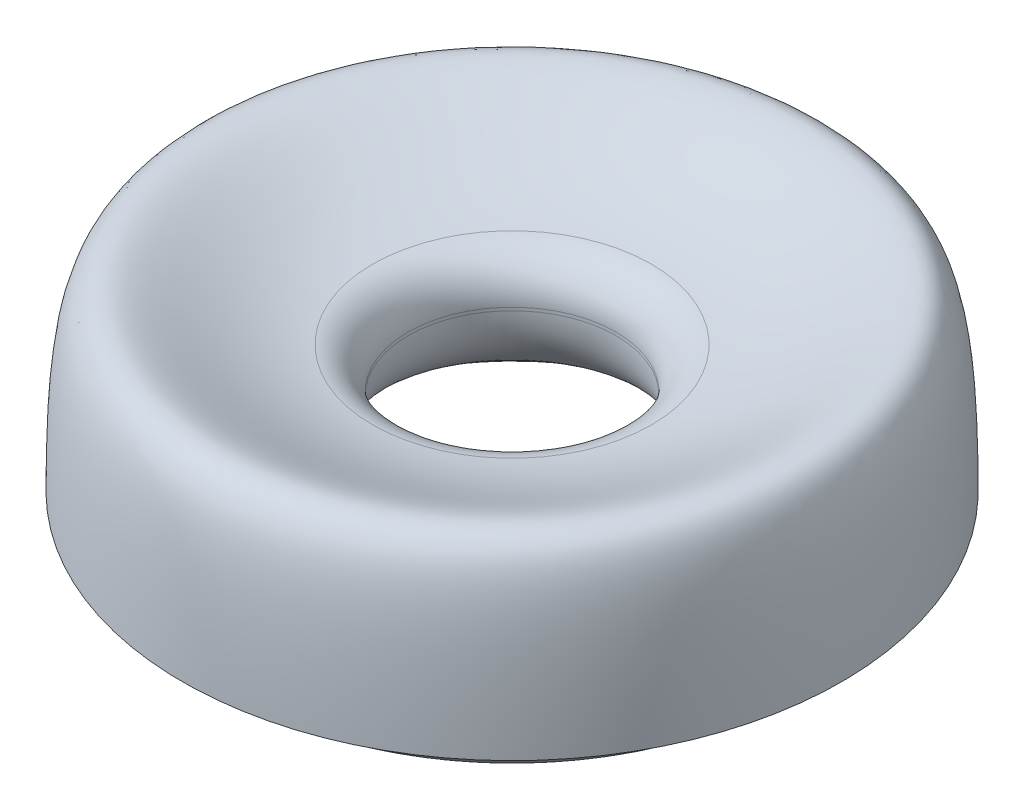
from build123d import *

# Parameters (mm, degrees)
FILLET_1_R = 1


with BuildPart() as part:
    # 草图1 → 旋转1 (revolve)
    with BuildSketch(Plane(origin=(0, 0, 0), x_dir=(0, 0, -1), z_dir=(1, 0, 0)), mode=Mode.PRIVATE) as revolve_1_sk:
        with BuildLine():
            Line((-6.928164391, 112), (-7.928164391, 112))
            add(Edge.make_bspline(
                [(-7.928164391, 112), (-7.928164391, 119.236034272), (-6.5, 115), (-2.5, 115)],
                knots=[0, 0, 0, 0, 1, 1, 1, 1], degree=3))
            Line((-2.5, 115), (-2.5, 114))
            add(Edge.make_bspline(
                [(-4.928164391, 111), (-4.928164391, 112.00000018), (-2.5, 112.00000018), (-2.5, 114)],
                knots=[0, 0, 0, 0, 1, 1, 1, 1], degree=3))
            Line((-4.928164391, 111), (-6.428164391, 111))
            ThreePointArc((-6.428164391, 111), (-6.781717782, 111.146446609), (-6.928164391, 111.5))
            Line((-6.928164391, 111.5), (-6.928164391, 112))
        make_face()
    revolve(revolve_1_sk.sketch.rotate(Axis((0, 103.198398654, 0), (0, 1, 0)), 180), axis=Axis((0, 103.198398654, 0), (0, 1, 0)))

    # 圆角1
    fillet_1_edges = [part.edges().sort_by_distance(p)[0] for p in [
        (0, 115, 2.5),
        (0, 111, 4.928164391),
    ]]
    fillet(fillet_1_edges, radius=FILLET_1_R)


solid = part.part
